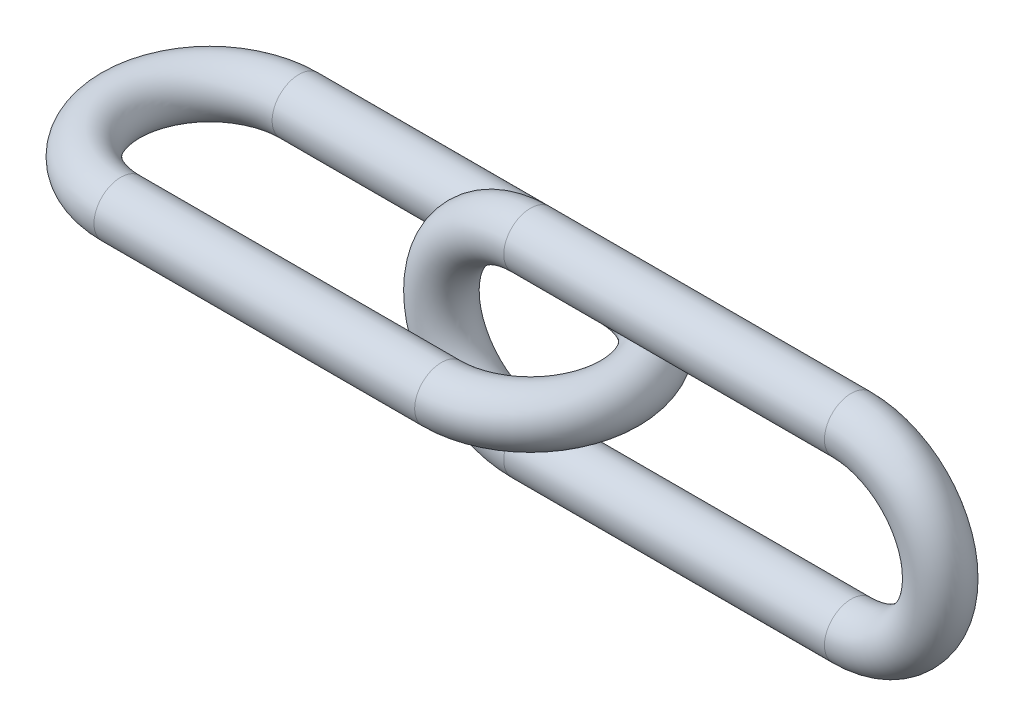
from build123d import *

# Parameters (mm, degrees)
SKETCH30_R          = 15
BOSS_EXTRUDE3_DEPTH = 180
SKETCH4_R           = 15
BOSS_EXTRUDE4_DEPTH = 180
SKETCH73_R          = 15
BOSS_EXTRUDE5_DEPTH = 180
SKETCH72_R          = 15
BOSS_EXTRUDE6_DEPTH = 180
SKETCH91_R          = 15
REVOLVE4_ANGLE      = 180
SKETCH92_R          = 15
REVOLVE5_ANGLE      = 180
SKETCH93_R          = 15
REVOLVE6_ANGLE      = 180
SKETCH94_R          = 15
REVOLVE7_ANGLE      = 180


with BuildPart() as part:
    # Sketch30 → Boss-Extrude3 (new body)
    with BuildSketch(Plane(origin=(180, 0, 0), x_dir=(0, 0, -1), z_dir=(1, 0, 0))):
        with Locations((0, 50)):
            Circle(SKETCH30_R)
    extrude(amount=-BOSS_EXTRUDE3_DEPTH)



with BuildPart() as body_2:
    # Sketch4 → Boss-Extrude4 (new body)
    with BuildSketch(Plane(origin=(0, 0, 0), x_dir=(0, 0, -1), z_dir=(1, 0, 0))):
        with Locations((0, -50)):
            Circle(SKETCH4_R)
    extrude(amount=BOSS_EXTRUDE4_DEPTH)


with BuildPart() as body_3:
    # Sketch73 → Boss-Extrude5 (new body)
    with BuildSketch(Plane(origin=(0, 0, 0), x_dir=(0, 0, -1), z_dir=(1, 0, 0))):
        with Locations((50, 0)):
            Circle(SKETCH73_R)
    extrude(amount=-BOSS_EXTRUDE5_DEPTH)



with BuildPart() as body_4:
    # Sketch72 → Boss-Extrude6 (new body)
    with BuildSketch(Plane(origin=(-180, 0, 0), x_dir=(0, 0, -1), z_dir=(1, 0, 0))):
        with Locations((-50, 0)):
            Circle(SKETCH72_R)
    extrude(amount=BOSS_EXTRUDE6_DEPTH)


with BuildPart() as part_1:
    add(part.part)

    add(body_2.part)  # Revolve4 merges body 2
    # Sketch91 → Revolve4 (revolve)
    with BuildSketch(Plane(origin=(180, 0, 0), x_dir=(0, 0, -1), z_dir=(1, 0, 0))):
        with Locations((0, 50)):
            Circle(SKETCH91_R)
    revolve(axis=Axis((180, 0, 0), (0, 0, -1)), revolution_arc=REVOLVE4_ANGLE)

    # Sketch92 → Revolve5 (revolve)
    with BuildSketch(Plane.ZY):
        with Locations(Location((0, 50, 0), (0, 0, 90))):
            Circle(SKETCH92_R)
    revolve(axis=Axis((0, 0, 0), (0, 0, 1)), revolution_arc=REVOLVE5_ANGLE)


with BuildPart() as body_3_1:
    add(body_3.part)

    add(body_4.part)  # Revolve6 merges body 4
    # Sketch93 → Revolve6 (revolve)
    with BuildSketch(Plane.ZY.offset(180)):
        with Locations(Location((-50, 0, 0), (0, 0, 180))):
            Circle(SKETCH93_R)
    revolve(axis=Axis((-180, 0, 0), (0, 1, 0)), revolution_arc=REVOLVE6_ANGLE)

    # Sketch94 → Revolve7 (revolve)
    with BuildSketch(Plane(origin=(0, 0, 0), x_dir=(0, 0, -1), z_dir=(1, 0, 0))):
        with Locations((50, 0)):
            Circle(SKETCH94_R)
    revolve(axis=Axis((0, 0, 0), (0, -1, 0)), revolution_arc=REVOLVE7_ANGLE)


solid = Compound([part_1.part, body_3_1.part])
